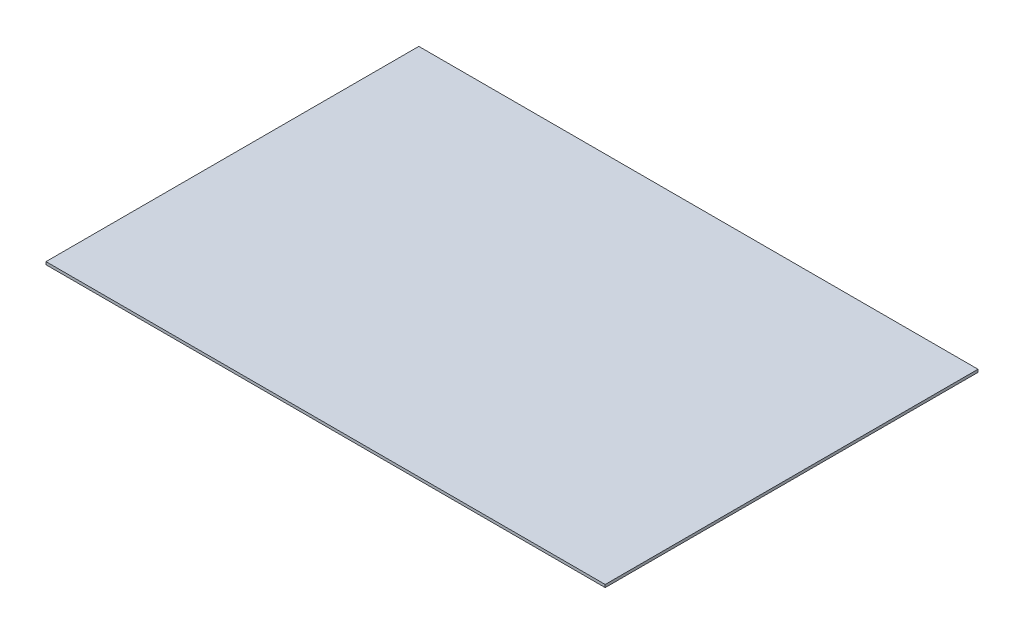
from build123d import *

# Parameters (mm, degrees)
SKETCH1_W           = 304.8
SKETCH1_H           = 203.2
BOSS_EXTRUDE1_DEPTH = 1.5


with BuildPart() as part:
    # Sketch1 → Boss-Extrude1 (new body)
    with BuildSketch(Plane(origin=(0, 0, 0), x_dir=(1, 0, 0), z_dir=(0, 1, 0))):
        Rectangle(SKETCH1_W, SKETCH1_H)
    extrude(amount=BOSS_EXTRUDE1_DEPTH)


solid = part.part
